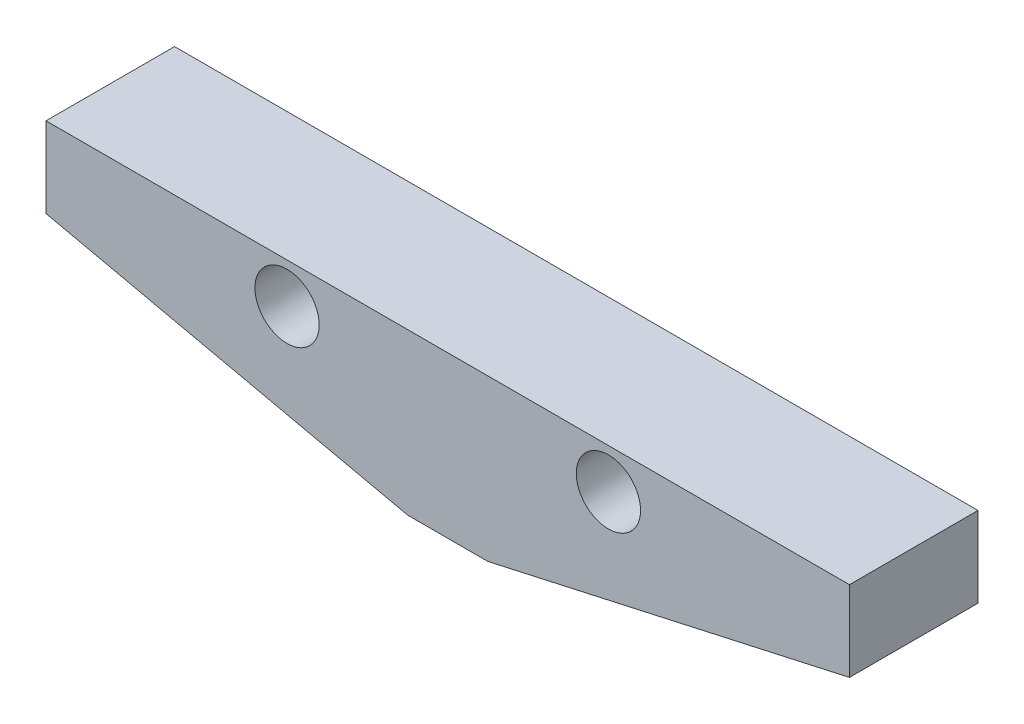
from build123d import *

# Parameters (mm, degrees)
EXTRUDE_1_DEPTH     = 8
SKETCH_2_R          = 1.25
CUT_EXTRUDE_1_DEPTH = 8
SKETCH_3_R          = 2
CUT_EXTRUDE_2_DEPTH = 4


with BuildPart() as part:
    # Эскиз1 → Бобышка-Вытянуть1 (new body)
    with BuildSketch(Plane.XY):
        Polygon((-25.856072272, 13.757630696), (24.143927728, 13.757630696), (24.143927728, 8.757630696), (1.643927728, 3.757630696), (-3.356072272, 3.757630696), (-25.856072272, 8.757630696), align=None)
    extrude(amount=EXTRUDE_1_DEPTH)

    # Эскиз2 → Вырез-Вытянуть1 (cut)
    with BuildSketch(Plane.XY.offset(8)):
        with Locations((-10.856072272, 11.257630696)):
            Circle(SKETCH_2_R)
        with Locations((9.143927728, 11.257630696)):
            Circle(SKETCH_2_R)
    extrude(amount=-CUT_EXTRUDE_1_DEPTH, mode=Mode.SUBTRACT)

    # Эскиз3 → Вырез-Вытянуть2 (cut)
    with BuildSketch(Plane.XY.offset(8)):
        with Locations((-10.856072272, 11.257630696)):
            Circle(SKETCH_3_R)
        with Locations((9.143927728, 11.257630696)):
            Circle(SKETCH_3_R)
    extrude(amount=-CUT_EXTRUDE_2_DEPTH, mode=Mode.SUBTRACT)


solid = part.part
